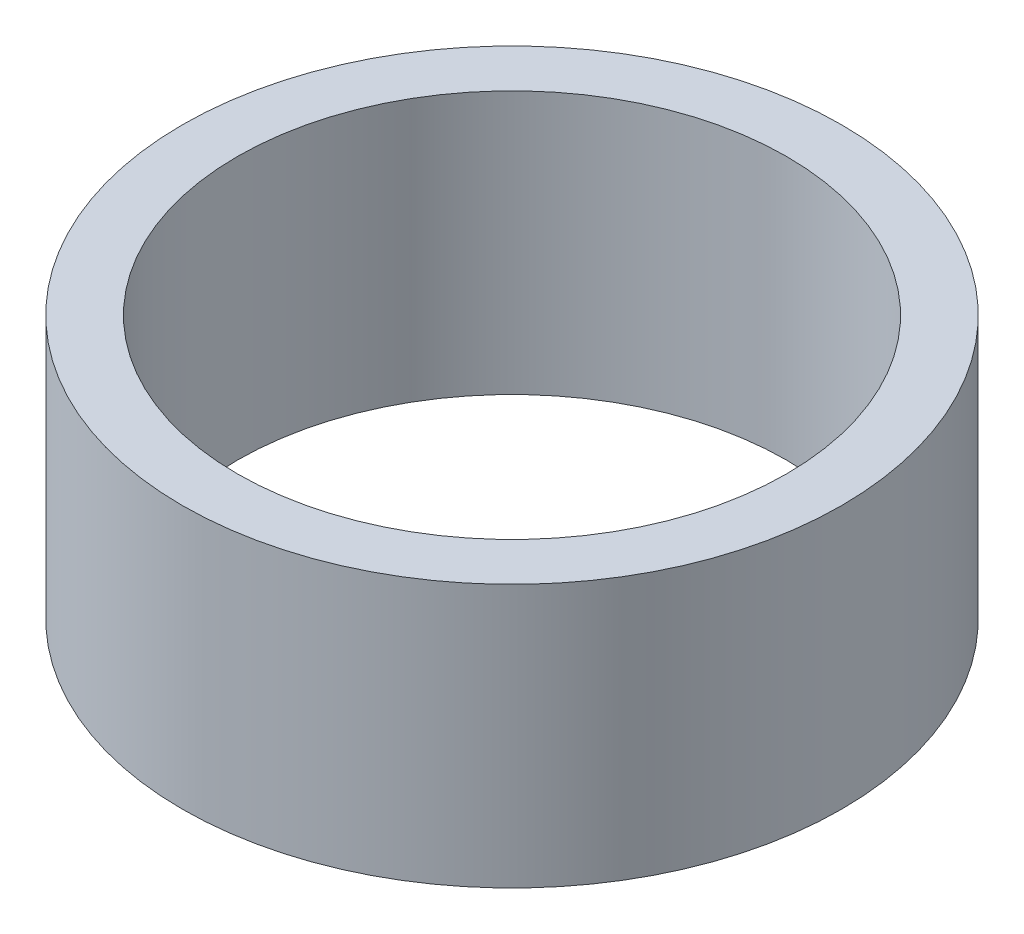
from build123d import *

# Parameters (mm, degrees)
SKETCH2_R           = 60
SKETCH2_R_2         = 50
BOSS_EXTRUDE1_DEPTH = 47.86


with BuildPart() as part:
    # Sketch2 → Boss-Extrude1 (new body)
    with BuildSketch(Plane(origin=(0, 0, 0), x_dir=(1, 0, 0), z_dir=(0, 1, 0))):
        with Locations(Location((0, 0, 0), (0, 0, 270))):
            Circle(SKETCH2_R)
        with Locations(Location((0, 0, 0), (0, 0, 270))):
            Circle(SKETCH2_R_2, mode=Mode.SUBTRACT)
    extrude(amount=BOSS_EXTRUDE1_DEPTH)


solid = part.part
